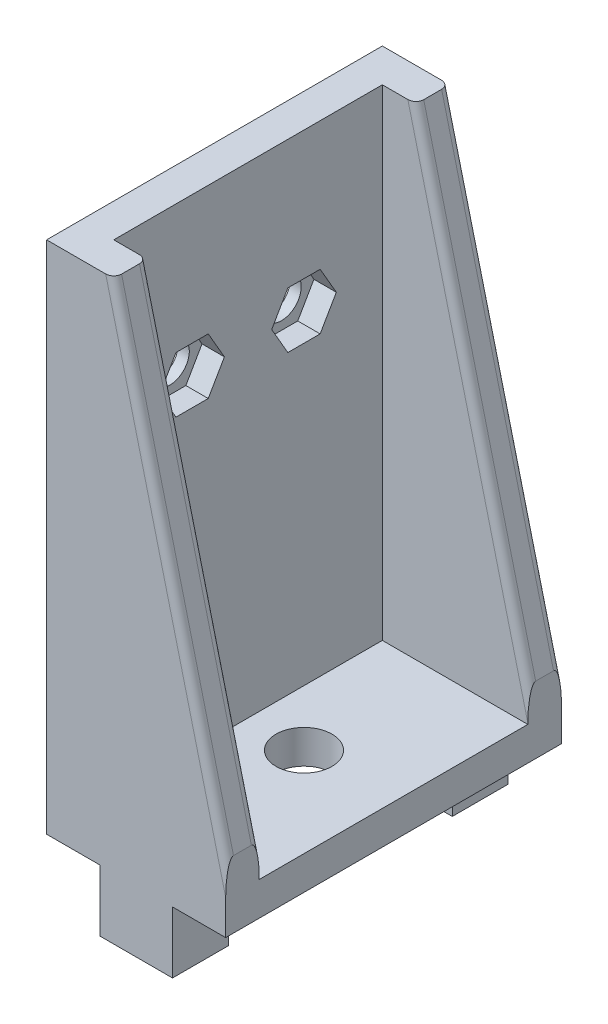
from build123d import *

# Parameters (mm, degrees)
SKETCH1_R               = 2.5
SKETCH1_W               = 6.5
SKETCH1_H               = 5
BOSS_EXTRUDE1_DEPTH     = 3
SKETCH1_3_W             = 6.5
SKETCH1_3_H             = 5
BOSS_EXTRUDE2_DEPTH     = 5.5
BOSS_EXTRUDE3_START     = -3
SKETCH2_W               = 3
SKETCH2_H               = 24
SKETCH2_H_2             = 3
SKETCH2_W_2             = 13
BOSS_EXTRUDE3_DEPTH     = 46
CUT_EXTRUDE1_DEPTH      = 56.497747702
CUT_EXTRUDE1_DEPTH_BACK = 56.497747702
CUT_EXTRUDE2_START      = -1
SKETCH4_R               = 1.75
CUT_EXTRUDE2_DEPTH      = 57.201398584
SKETCH4_2_R             = 1.75
CUT_EXTRUDE3_DEPTH      = 58.201398584
FILLET1_R               = 0.7


with BuildPart() as part:
    # Sketch1 → Boss-Extrude1 (new body)
    # profile 1 of 3: a face of its own
    with BuildSketch(Plane(origin=(0, 0, 0), x_dir=(1, 0, 0), z_dir=(0, 1, 0))):
        Polygon((-8, 30), (-8, 0), (-3.25, 0), (-3.25, 5), (3.25, 5), (3.25, 0), (8, 0), (8, 30), (3.25, 30), (3.25, 25), (-3.25, 25), (-3.25, 30), align=None)
        with Locations(Location((0, 15, 0), (0, 0, 270))):
            Circle(SKETCH1_R, mode=Mode.SUBTRACT)
    # profile 2 of 3: a face of its own
    with BuildSketch(Plane(origin=(0, 0, 0), x_dir=(1, 0, 0), z_dir=(0, 1, 0))):
        with Locations((0, 2.5)):
            Rectangle(SKETCH1_W, SKETCH1_H)
    # profile 3 of 3: a face of its own
    with BuildSketch(Plane(origin=(0, 0, 0), x_dir=(1, 0, 0), z_dir=(0, 1, 0))):
        with Locations((0, 27.5)):
            Rectangle(SKETCH1_W, SKETCH1_H)
    extrude(amount=BOSS_EXTRUDE1_DEPTH)

    # Sketch1<3> → Boss-Extrude2 (add)
    with BuildSketch(Plane(origin=(0, 0, 0), x_dir=(1, 0, 0), z_dir=(0, 1, 0))):
        with Locations((0, 27.5)):
            Rectangle(SKETCH1_3_W, SKETCH1_3_H)
        with Locations((0, 2.5)):
            Rectangle(SKETCH1_3_W, SKETCH1_3_H)
    extrude(amount=-BOSS_EXTRUDE2_DEPTH)

    # Sketch2 → Boss-Extrude3 (add)
    with BuildSketch(Plane(origin=(0, 3, 0), x_dir=(1, 0, 0), z_dir=(0, 1, 0)).offset(BOSS_EXTRUDE3_START)):
        with Locations((-6.5, 15)):
            Rectangle(SKETCH2_W, SKETCH2_H)
        with Locations((-6.5, 1.5)):
            Rectangle(SKETCH2_W, SKETCH2_H_2)
        with Locations((-6.5, 28.5)):
            Rectangle(SKETCH2_W, SKETCH2_H_2)
        with Locations((1.5, 28.5)):
            Rectangle(SKETCH2_W_2, SKETCH2_H_2)
        with Locations((1.5, 1.5)):
            Rectangle(SKETCH2_W_2, SKETCH2_H_2)
    extrude(amount=BOSS_EXTRUDE3_DEPTH)

    # Sketch3 → Cut-Extrude1 (cut, two sides: drawn at the far end of the back side and taken through both)
    with BuildSketch(Plane(origin=(0, 0, -30), x_dir=(-1, 0, 0), z_dir=(0, 0, -1)).offset(-CUT_EXTRUDE1_DEPTH_BACK)):
        Polygon((-8, 6), (2, 46), (-8, 46), align=None)
    extrude(amount=CUT_EXTRUDE1_DEPTH + CUT_EXTRUDE1_DEPTH_BACK, mode=Mode.SUBTRACT)

    # Sketch4 → Cut-Extrude2 (cut, through all)
    # profile 1 of 2: a face of its own
    with BuildSketch(Plane.ZY.offset(8).offset(CUT_EXTRUDE2_START)):
        Polygon((-8.556624327, 29.5), (-7.113248654, 32), (-8.556624327, 34.5), (-11.443375673, 34.5), (-12.886751346, 32), (-11.443375673, 29.5), align=None)
        with Locations((-10, 32)):
            Circle(SKETCH4_R, mode=Mode.SUBTRACT)
    # profile 2 of 2: a face of its own
    with BuildSketch(Plane.ZY.offset(8).offset(CUT_EXTRUDE2_START)):
        Polygon((-18.556624327, 29.5), (-17.113248654, 32), (-18.556624327, 34.5), (-21.443375673, 34.5), (-22.886751346, 32), (-21.443375673, 29.5), align=None)
        with Locations((-20, 32)):
            Circle(SKETCH4_R, mode=Mode.SUBTRACT)
    extrude(amount=-CUT_EXTRUDE2_DEPTH, mode=Mode.SUBTRACT)

    # Sketch4<2> → Cut-Extrude3 (cut, through all)
    with BuildSketch(Plane.ZY.offset(8)):
        with Locations((-20, 32)):
            Circle(SKETCH4_2_R)
        with Locations((-10, 32)):
            Circle(SKETCH4_2_R)
    extrude(amount=-CUT_EXTRUDE3_DEPTH, mode=Mode.SUBTRACT)

    # Fillet1
    fillet1_edges = [part.edges().sort_by_distance(p)[0] for p in [
        (3, 26, -30),
        (3, 26, -27),
        (3, 26, 0),
        (3, 26, -3),
    ]]
    fillet(fillet1_edges, radius=FILLET1_R)


solid = part.part
